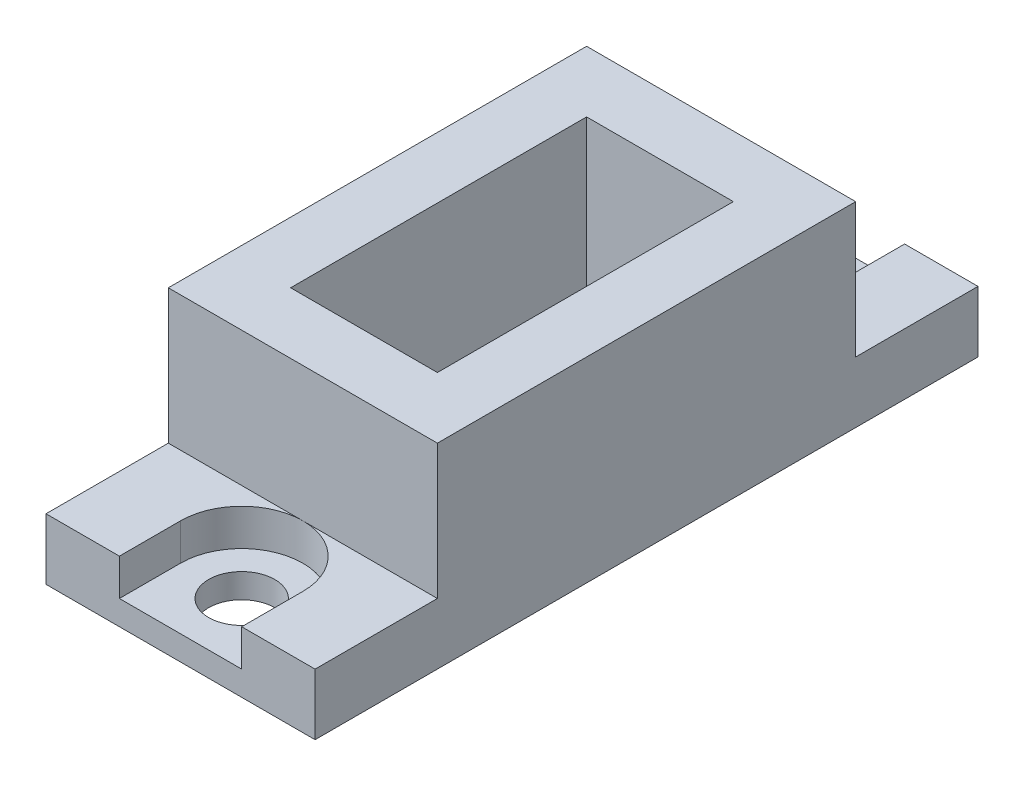
from build123d import *

# Parameters (mm, degrees)
SKETCH3_W           = 22
SKETCH3_H           = 34.2
SKETCH3_W_2         = 12
SKETCH3_H_2         = 24.2
BOSS_EXTRUDE1_DEPTH = 16
SKETCH4_W           = 22
SKETCH4_H           = 10
BOSS_EXTRUDE2_DEPTH = 5
CUT_EXTRUDE6_DEPTH  = 3
SKETCH12_R          = 2.7
CUT_EXTRUDE7_DEPTH  = 3


with BuildPart() as part:
    # Sketch3 → Boss-Extrude1 (new body)
    with BuildSketch(Plane(origin=(0, 0, 0), x_dir=(1, 0, 0), z_dir=(0, 1, 0))):
        with Locations((6, 14.151918963)):
            Rectangle(SKETCH3_W, SKETCH3_H)
        with Locations((6, 14.151918963)):
            Rectangle(SKETCH3_W_2, SKETCH3_H_2, mode=Mode.SUBTRACT)
    extrude(amount=BOSS_EXTRUDE1_DEPTH)

    # Sketch4 → Boss-Extrude2 (add)
    with BuildSketch(Plane(origin=(0, 0, 0), x_dir=(1, 0, 0), z_dir=(0, 1, 0))):
        with Locations((6, 36.251918963)):
            Rectangle(SKETCH4_W, SKETCH4_H)
        with Locations((6, -7.948081037)):
            Rectangle(SKETCH4_W, SKETCH4_H)
    extrude(amount=BOSS_EXTRUDE2_DEPTH)

    # Sketch8 → Cut-Extrude6 (cut)
    with BuildSketch(Plane(origin=(0, 5, 0), x_dir=(1, 0, 0), z_dir=(0, 1, 0))):
        with BuildLine():
            Line((1, 36.251918963), (1, 41.251918963))
            Line((1, 41.251918963), (11, 41.251918963))
            Line((11, 41.251918963), (11, 36.251918963))
            ThreePointArc((11, 36.251918963), (9.535533906, 32.716385057), (6, 31.251918963))
            ThreePointArc((6, 31.251918963), (2.464466094, 32.716385057), (1, 36.251918963))
        make_face()
        with BuildLine():
            Line((1, -7.948081037), (1, -12.948081037))
            Line((1, -12.948081037), (11, -12.948081037))
            Line((11, -12.948081037), (11, -7.948081037))
            ThreePointArc((11, -7.948081037), (9.535533906, -4.412547131), (6, -2.948081037))
            ThreePointArc((6, -2.948081037), (2.464466094, -4.412547131), (1, -7.948081037))
        make_face()
    extrude(amount=-CUT_EXTRUDE6_DEPTH, mode=Mode.SUBTRACT)

    # Sketch12 → Cut-Extrude7 (cut)
    with BuildSketch(Plane.XZ):
        with Locations(Location((6, 7.948081037, 0), (0, 0, 270))):
            Circle(SKETCH12_R)
        with Locations(Location((6, -36.251918963, 0), (0, 0, 270))):
            Circle(SKETCH12_R)
    extrude(amount=-CUT_EXTRUDE7_DEPTH, mode=Mode.SUBTRACT)


solid = part.part
